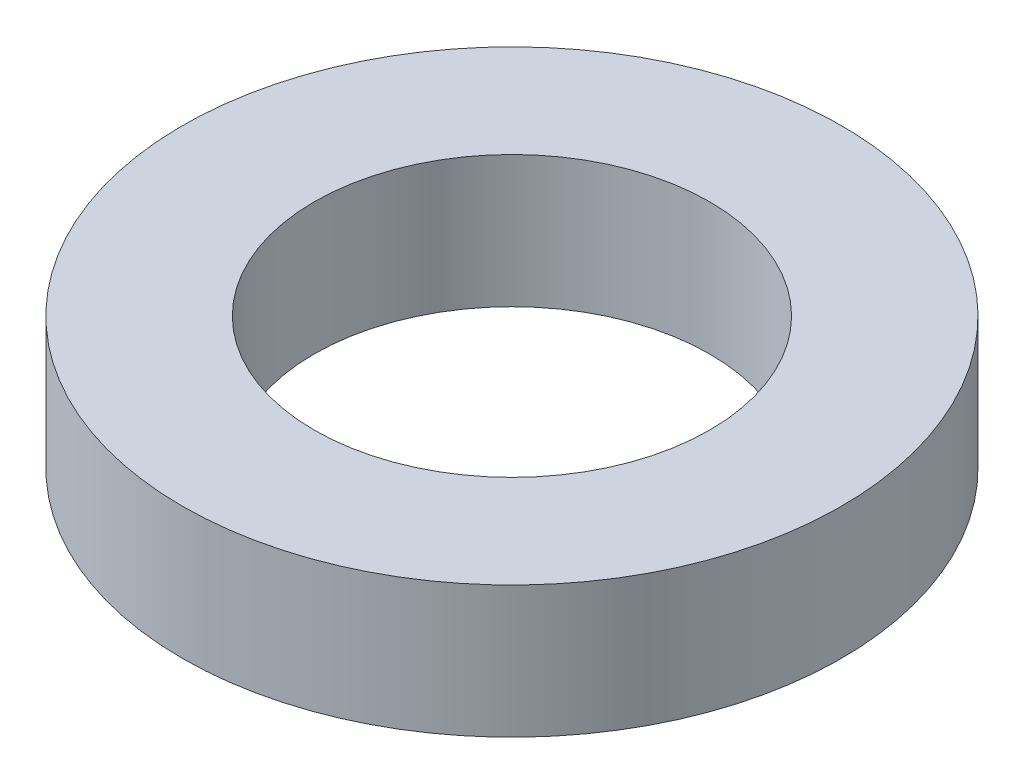
from build123d import *

# Parameters (mm, degrees)
CROQUIS1_R              = 2.5
CROQUIS1_R_2            = 1.5
SALIENTE_EXTRUIR1_DEPTH = 1


with BuildPart() as part:
    # Croquis1 → Saliente-Extruir1 (new body)
    with BuildSketch(Plane(origin=(0, 0, 0), x_dir=(1, 0, 0), z_dir=(0, 1, 0))):
        with Locations(Location((0, 0, 0), (0, 0, 270))):
            Circle(CROQUIS1_R)
        with Locations(Location((0, 0, 0), (0, 0, 270))):
            Circle(CROQUIS1_R_2, mode=Mode.SUBTRACT)
    extrude(amount=SALIENTE_EXTRUIR1_DEPTH)


solid = part.part
